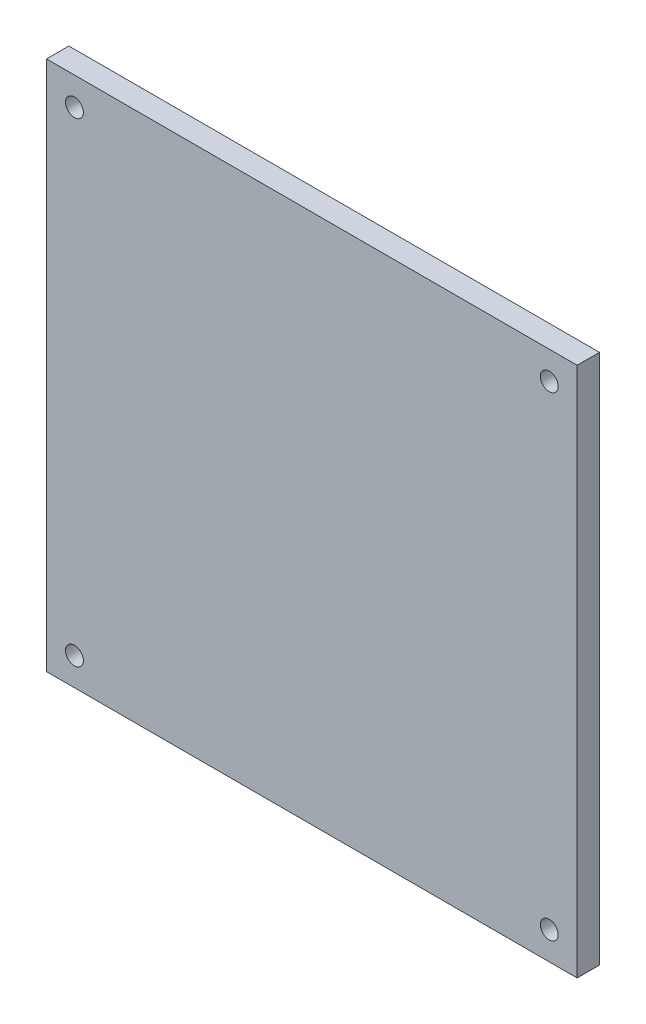
from build123d import *

# Parameters (mm, degrees)
SKETCH_1_W          = 47.5
SKETCH_1_H          = 47.5
EXTRUDE_1_DEPTH     = 2
SKETCH_2_R          = 0.8
CUT_EXTRUDE_1_DEPTH = 2


with BuildPart() as part:
    # 草图1 → 凸台-拉伸1 (new body)
    with BuildSketch(Plane.XY):
        with Locations((23.75, 23.75)):
            Rectangle(SKETCH_1_W, SKETCH_1_H)
    extrude(amount=EXTRUDE_1_DEPTH)

    # 草图2 → 切除-拉伸1 (cut)
    with BuildSketch(Plane.XY.offset(2)):
        with Locations((2.5, 2.5)):
            Circle(SKETCH_2_R)
        with Locations((2.5, 45)):
            Circle(SKETCH_2_R)
        with Locations((45, 45)):
            Circle(SKETCH_2_R)
        with Locations((45, 2.5)):
            Circle(SKETCH_2_R)
    extrude(amount=-CUT_EXTRUDE_1_DEPTH, mode=Mode.SUBTRACT)


solid = part.part
